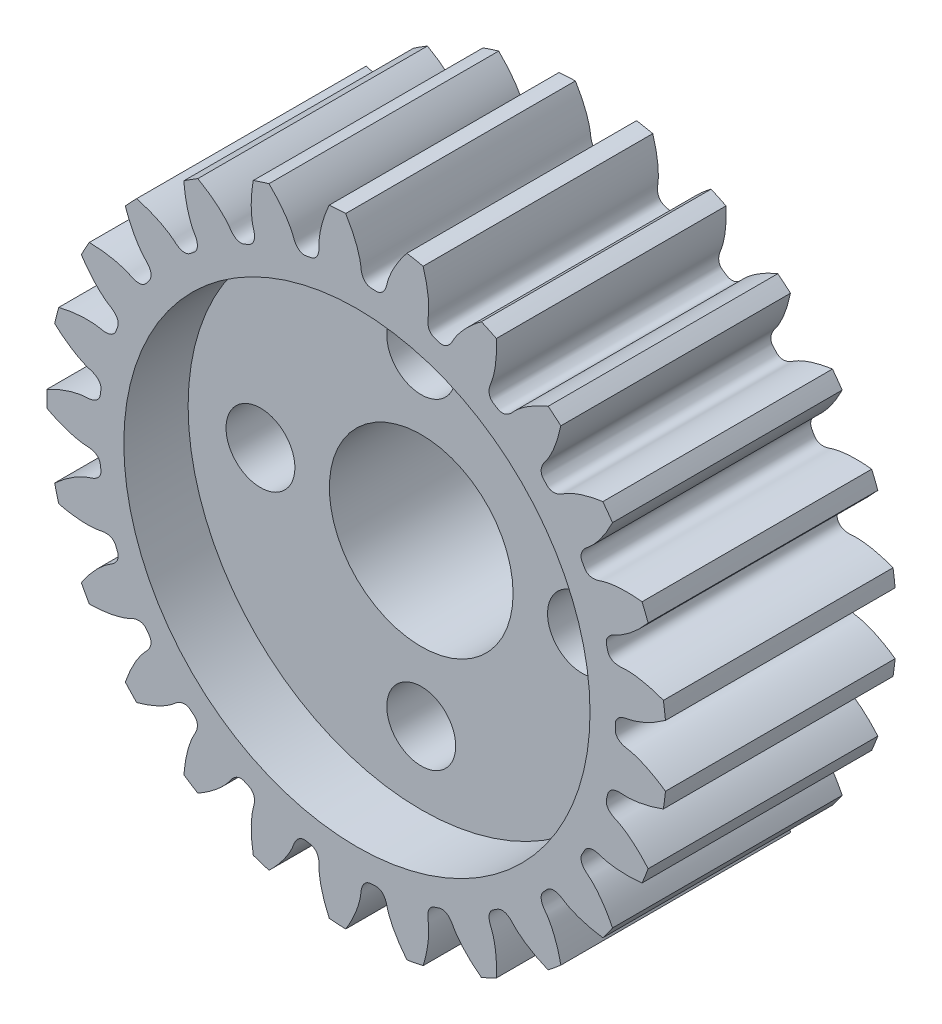
from build123d import *

# Parameters (mm, degrees)
SKETCHREVOLVESPURPINION_W       = 10
SKETCHREVOLVESPURPINION_H       = 13.5
TOOTHEXTRUDECUTSPURPINION_DEPTH = 5
PATTERNSPURPINION_COUNT         = 25
SKETCH_6_R                      = 10.15
CUT_EXTRUDE_3_DEPTH             = 2.8
SKETCH_5_R                      = 1.5
SKETCH_5_R_2                    = 4
CUT_EXTRUDE_2_DEPTH             = 22.546731677


with BuildPart() as part:
    # SketchRevolveSpurPinion → SpurPinion (revolve)
    with BuildSketch(Plane(origin=(0, 0, 0), x_dir=(0, 0, -1), z_dir=(1, 0, 0))):
        with Locations((0, 6.75)):
            Rectangle(SKETCHREVOLVESPURPINION_W, SKETCHREVOLVESPURPINION_H)
    revolve(axis=Axis((0, 0, 0), (0, 0, -1)))

    # SketchToothSpurPinion → ToothExtrudeCutSpurPinion (cut, symmetric)
    with BuildSketch(Plane.XY):
        with BuildLine():
            ThreePointArc((13.480791283, 1.367759625), (13.55, 0), (13.480791283, -1.367759625))
            add(Edge.make_bspline(
                [(13.480791283, -1.367759625), (13.334851997, -1.262950532), (13.140154587, -1.134395748), (12.894717923, -0.992950407), (12.762175096, -0.921557693), (12.636316471, -0.858359043), (12.517496578, -0.802907874), (12.406049525, -0.754743793), (12.302288763, -0.713393629), (12.206506359, -0.678373389), (12.118973381, -0.649184949), (12.039937001, -0.625330251), (11.969628061, -0.606270085), (11.908236316, -0.591554778), (11.824282624, -0.573689452), (11.750470119, -0.563846802), (11.686209075, -0.548996135), (11.6588546, -0.54197421), (11.632090505, -0.534294975), (11.605877504, -0.52594014), (11.580175457, -0.516856549), (11.554939444, -0.506983077), (11.530121538, -0.496239473), (11.50567193, -0.484524316), (11.481541602, -0.471709578), (11.457686718, -0.457635165), (11.434075759, -0.442102866), (11.410700586, -0.424870732), (11.387592911, -0.405649441), (11.364847598, -0.38410361), (11.342653429, -0.359862855), (11.32132951, -0.332549492), (11.301360946, -0.301830514), (11.283418243, -0.267499863), (11.268343357, -0.229582609), (11.257058297, -0.188451846), (11.250882973, -0.147582949), (11.248232424, -0.08448511), (11.251319536, 0), (11.248232424, 0.08448511), (11.250882973, 0.147582949), (11.257058297, 0.188451846), (11.268343357, 0.229582609), (11.283418243, 0.267499863), (11.301360946, 0.301830514), (11.32132951, 0.332549492), (11.342653429, 0.359862855), (11.364847598, 0.38410361), (11.387592911, 0.405649441), (11.410700586, 0.424870732), (11.434075759, 0.442102866), (11.457686718, 0.457635165), (11.481541602, 0.471709578), (11.50567193, 0.484524316), (11.530121538, 0.496239473), (11.554939444, 0.506983077), (11.580175457, 0.516856549), (11.605877504, 0.52594014), (11.632090505, 0.534294975), (11.6588546, 0.54197421), (11.686209075, 0.548996135), (11.750470119, 0.563846802), (11.824282624, 0.573689452), (11.908236316, 0.591554778), (11.969628061, 0.606270085), (12.039937001, 0.625330251), (12.118973381, 0.649184949), (12.206506359, 0.678373389), (12.302288763, 0.713393629), (12.406049525, 0.754743793), (12.517496578, 0.802907874), (12.636316471, 0.858359043), (12.762175096, 0.921557693), (12.894717923, 0.992950407), (13.140154587, 1.134395748), (13.334851997, 1.262950532), (13.480791283, 1.367759625)],
                knots=[0, 0, 0, 0, 0.097254541, 0.126170097, 0.153333195, 0.178743836, 0.202402018, 0.224307742, 0.244461009, 0.262861818, 0.279510168, 0.294406061, 0.307549496, 0.318940474, 0.328578993, 0.354007628, 0.35918316, 0.364275529, 0.369295266, 0.374254533, 0.379167399, 0.384050186, 0.388921844, 0.393804391, 0.398723371, 0.403708329, 0.408793208, 0.414016582, 0.419421505, 0.425054685, 0.430964534, 0.437197553, 0.443792505, 0.45077224, 0.45813389, 0.465839744, 0.473812597, 0.480450502, 0.5, 0.519549498, 0.526187403, 0.534160256, 0.54186611, 0.54922776, 0.556207495, 0.562802447, 0.569035466, 0.574945315, 0.580578495, 0.585983418, 0.591206792, 0.596291671, 0.601276629, 0.606195609, 0.611078156, 0.615949814, 0.620832601, 0.625745467, 0.630704734, 0.635724471, 0.64081684, 0.645992372, 0.671421007, 0.681059526, 0.692450504, 0.705593939, 0.720489832, 0.737138182, 0.755538991, 0.775692258, 0.797597982, 0.821256164, 0.846666805, 0.873829903, 0.902745459, 1, 1, 1, 1], degree=3))
        make_face()
    toothextrudecutspurpinion = extrude(amount=TOOTHEXTRUDECUTSPURPINION_DEPTH, both=True, mode=Mode.SUBTRACT)

    # PatternSpurPinion: ToothExtrudeCutSpurPinion ×25 about axis
    patternspurpinion_axis = Axis((0, 0, 50), (0, 0, -1))
    for i in range(1, PATTERNSPURPINION_COUNT):
        add(toothextrudecutspurpinion.rotate(patternspurpinion_axis, i * 360 / PATTERNSPURPINION_COUNT), mode=Mode.SUBTRACT)

    # Эскиз6 → Вырез-Вытянуть3 (cut)
    with BuildSketch(Plane.XY.offset(5)):
        Circle(SKETCH_6_R)
    extrude(amount=-CUT_EXTRUDE_3_DEPTH, mode=Mode.SUBTRACT)

    # Эскиз5 → Вырез-Вытянуть2 (cut, through all)
    with BuildSketch(Plane.XY.offset(5)):
        with Locations((0, 7)):
            Circle(SKETCH_5_R)
        with Locations((7, 0)):
            Circle(SKETCH_5_R)
        with Locations((0, -7)):
            Circle(SKETCH_5_R)
        with Locations((-7, 0)):
            Circle(SKETCH_5_R)
        Circle(SKETCH_5_R_2)
    extrude(amount=-CUT_EXTRUDE_2_DEPTH, mode=Mode.SUBTRACT)


solid = part.part
